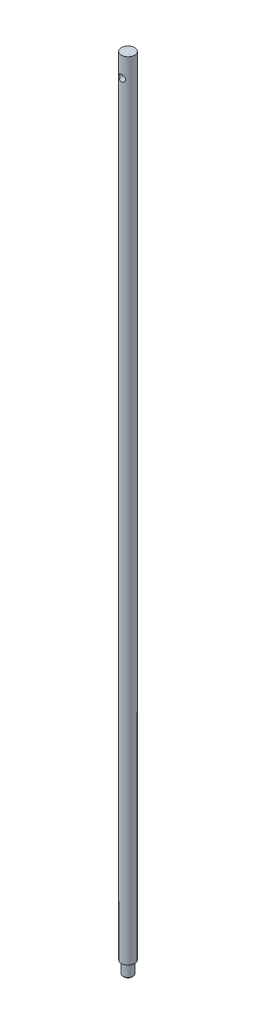
from build123d import *

# Parameters (mm, degrees)
CHAMFER1_SIZE           = 1.27
CUT_EXTRUDE1_DEPTH      = 769.402477547
CUT_EXTRUDE1_DEPTH_BACK = 769.402477547
SKETCH2_R               = 3.175


with BuildPart() as part:
    # Sketch1 → Revolve1 (revolve)
    with BuildSketch(Plane.XY, mode=Mode.PRIVATE) as revolve1_sk:
        Polygon((0, 0), (0, 768.35), (-6.35, 768.35), (-6.35, 12.7), (-4.7625, 12.7), (-4.7625, 0), align=None)
    revolve(revolve1_sk.sketch.rotate(Axis((0, 0, 0), (0, 1, 0)), 270), axis=Axis((0, 0, 0), (0, 1, 0)))

    # Chamfer1
    chamfer1_edges = [part.edges().sort_by_distance(p)[0] for p in [
        (0, 0, 4.7625),
    ]]
    chamfer(chamfer1_edges, length=CHAMFER1_SIZE)

    # Sketch2 → Cut-Extrude1 (cut, two sides: drawn at the far end of the back side and taken through both)
    with BuildSketch(Plane.XY.offset(-CUT_EXTRUDE1_DEPTH_BACK)):
        with Locations((0, 749.3)):
            Circle(SKETCH2_R)
    extrude(amount=CUT_EXTRUDE1_DEPTH + CUT_EXTRUDE1_DEPTH_BACK, mode=Mode.SUBTRACT)


solid = part.part
